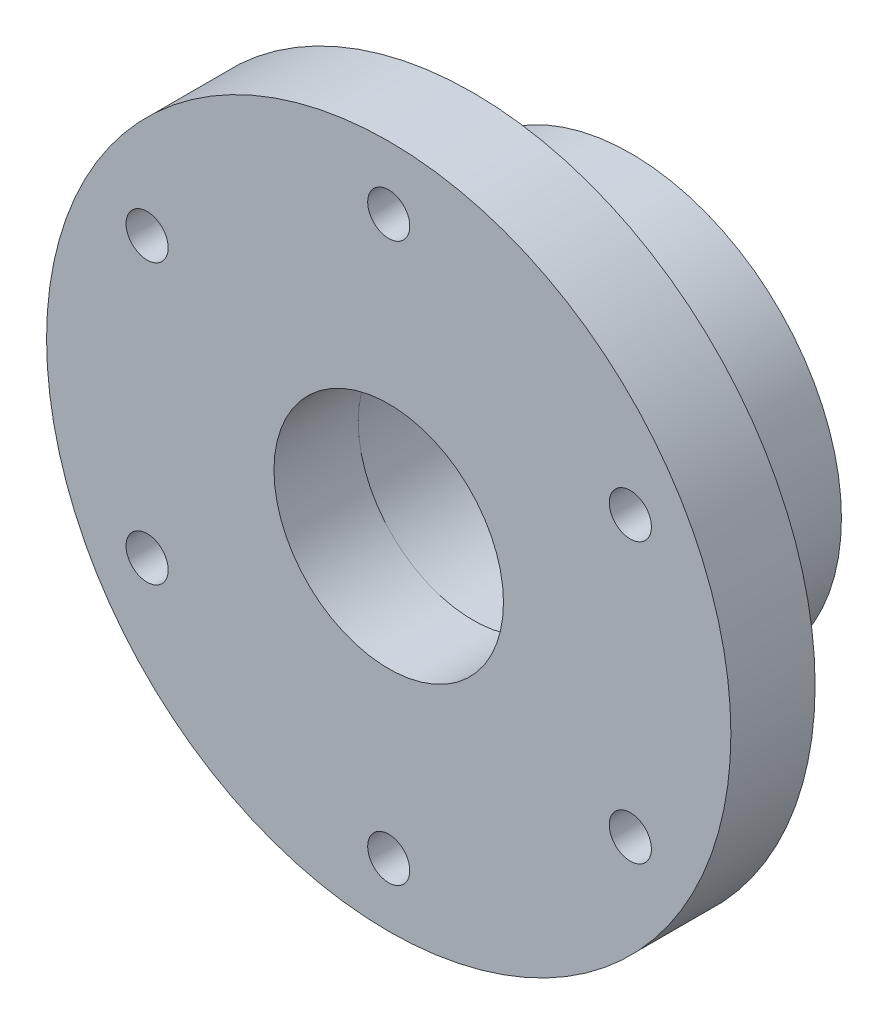
from build123d import *

# Parameters (mm, degrees)
EXTRUDE_START       = 50
SKETCH_1_R          = 20
SKETCH_1_R_2        = 11
EXTRUDE_1_DEPTH     = 15
SKETCH_2_R          = 32.5
SKETCH_2_R_2        = 10.9
EXTRUDE_2_DEPTH     = 8
SKETCH_3_R          = 2
CUT_EXTRUDE_3_DEPTH = 49.347699015


with BuildPart() as part:
    # Эскиз1 → Вытянуть1 (new body)
    with BuildSketch(Plane.XY.offset(EXTRUDE_START)):
        Circle(SKETCH_1_R)
        Circle(SKETCH_1_R_2, mode=Mode.SUBTRACT)
    extrude(amount=EXTRUDE_1_DEPTH)

    # Эскиз2 → Вытянуть2 (add)
    with BuildSketch(Plane.XY.offset(65)):
        Circle(SKETCH_2_R)
        Circle(SKETCH_2_R_2, mode=Mode.SUBTRACT)
    extrude(amount=EXTRUDE_2_DEPTH)

    # Эскиз3 → Вытянуть3 (cut, through all)
    with BuildSketch(Plane(origin=(0, 0, 65), x_dir=(-1, 0, 0), z_dir=(0, 0, -1))):
        with Locations((0, 26.5)):
            Circle(SKETCH_3_R)
        with Locations((22.9496732, 13.25)):
            Circle(SKETCH_3_R)
        with Locations((22.9496732, -13.25)):
            Circle(SKETCH_3_R)
        with Locations((0, -26.5)):
            Circle(SKETCH_3_R)
        with Locations((-22.9496732, -13.25)):
            Circle(SKETCH_3_R)
        with Locations((-22.9496732, 13.25)):
            Circle(SKETCH_3_R)
    extrude(amount=-CUT_EXTRUDE_3_DEPTH, mode=Mode.SUBTRACT)


solid = part.part
